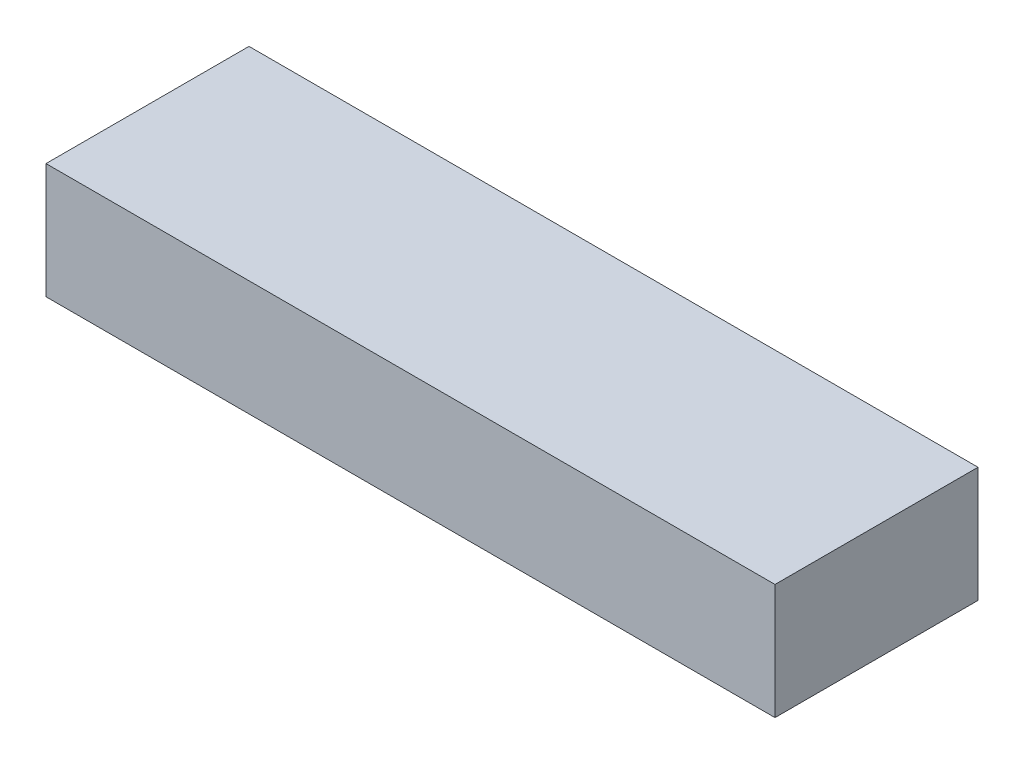
from build123d import *

# Parameters (mm, degrees)
CROQUIS1_W              = 158
CROQUIS1_H              = 44
SALIENTE_EXTRUIR1_DEPTH = 25


with BuildPart() as part:
    # Croquis1 → Saliente-Extruir1 (new body)
    with BuildSketch(Plane(origin=(0, 0, 0), x_dir=(1, 0, 0), z_dir=(0, 1, 0))):
        Rectangle(CROQUIS1_W, CROQUIS1_H)
    extrude(amount=SALIENTE_EXTRUIR1_DEPTH)


solid = part.part
